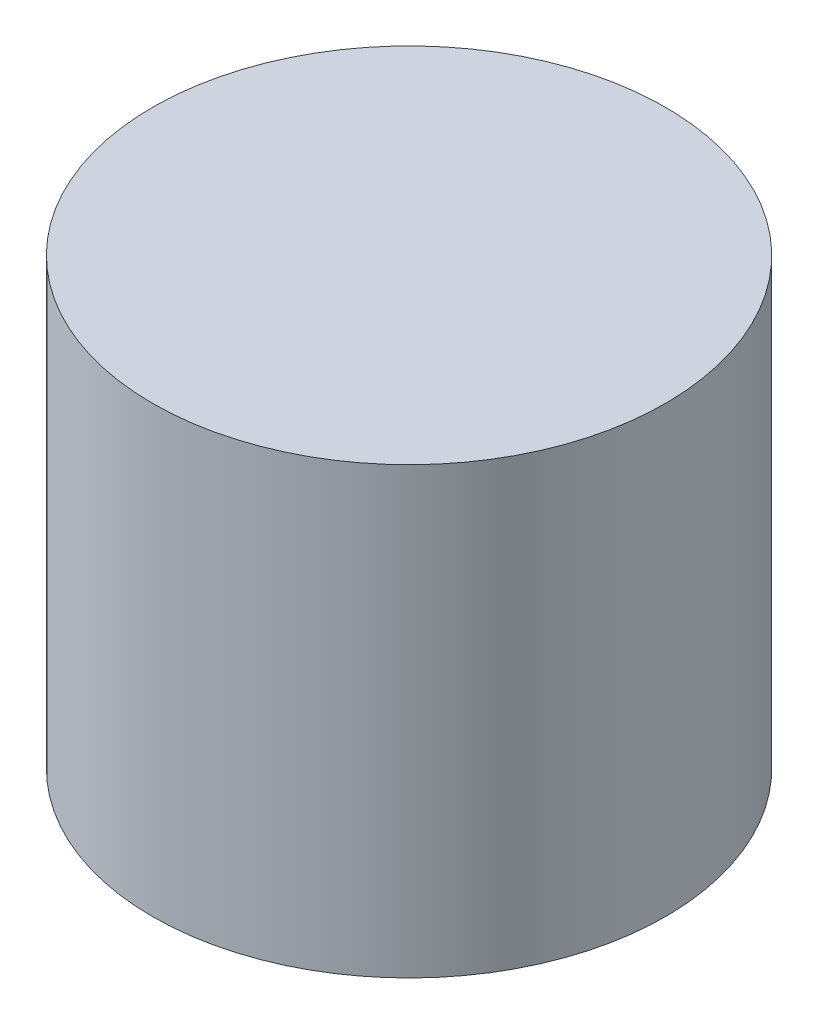
from build123d import *

# Parameters (mm, degrees)
SKETCH1_R           = 75
BOSS_EXTRUDE1_DEPTH = 130


with BuildPart() as part:
    # Sketch1 → Boss-Extrude1 (new body)
    with BuildSketch(Plane(origin=(0, 0, 0), x_dir=(1, 0, 0), z_dir=(0, 1, 0))):
        with Locations(Location((0, 0, 0), (0, 0, 270))):
            Circle(SKETCH1_R)
    extrude(amount=BOSS_EXTRUDE1_DEPTH)


solid = part.part
